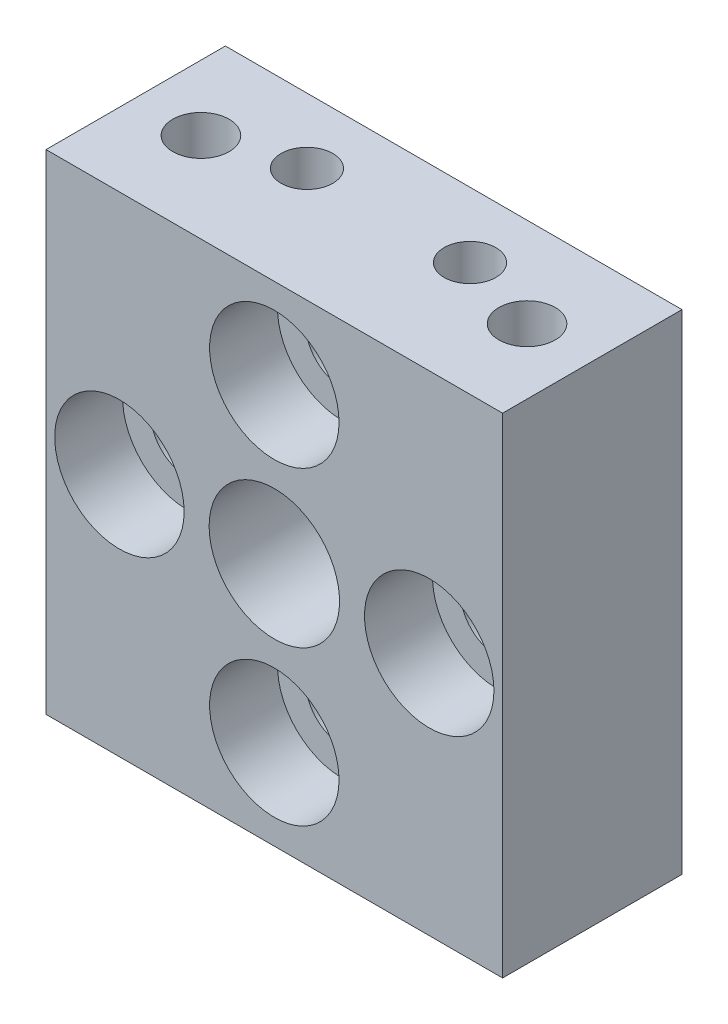
from build123d import *

# Parameters (mm, degrees)
SKETCH1_W                                      = 28
SKETCH1_H                                      = 30
BOSS_EXTRUDE1_DEPTH                            = 11
CBORE_FOR_8_SOCKET_HEAD_CAP_SCREW3_D           = 4.4958
CBORE_FOR_8_SOCKET_HEAD_CAP_SCREW3_CBORE_D     = 7.9375
CBORE_FOR_8_SOCKET_HEAD_CAP_SCREW3_CBORE_DEPTH = 4.1656
F_8_32_TAPPED_HOLE1_AT_2_COUNT                 = 2
F_8_32_TAPPED_HOLE1_AT_2_PITCH                 = 20
F_1_8_0_1250_DOWEL_HOLE1_AT_2_COUNT            = 2
F_1_8_0_1250_DOWEL_HOLE1_AT_2_PITCH            = 10


with BuildPart() as part:
    # Sketch1 → Boss-Extrude1 (new body)
    with BuildSketch(Plane.XY):
        with Locations((14, 0)):
            Rectangle(SKETCH1_W, SKETCH1_H)
    extrude(amount=BOSS_EXTRUDE1_DEPTH)

    # Sketch16 → CBORE for M5 Hex Head Bolt1 (revolve, cut)
    with BuildSketch(Plane.YZ.offset(14)):
        Polygon((0, 0), (0, 11), (4, 11), (4, 3.25), (4.25, 3), (5.5, 3), (5.5, 1), (6.5, 0), align=None)
    revolve(axis=Axis((14, 0, -6.35), (0, 0, 1)), mode=Mode.SUBTRACT)

    # CBORE for #8 Socket Head Cap Screw3 (through all)
    with Locations(Plane.XY.offset(11)):
        with Locations((23.5, 0), (4.5, 0), (14, 9.5), (14, -9.5)):
            CounterBoreHole(CBORE_FOR_8_SOCKET_HEAD_CAP_SCREW3_D / 2, CBORE_FOR_8_SOCKET_HEAD_CAP_SCREW3_CBORE_D / 2, CBORE_FOR_8_SOCKET_HEAD_CAP_SCREW3_CBORE_DEPTH)

    # Sketch13 → #8-32 Tapped Hole1 (revolve, cut)
    with BuildSketch(Plane(origin=(4, 15, 5.5), x_dir=(0, 0, 1), z_dir=(1, 0, 0))):
        Polygon((0, 0), (0, 11.037806461), (1.7272, 10), (1.7272, 0), align=None)
    f_8_32_tapped_hole1 = revolve(axis=Axis((4, 21.35, 5.5), (0, -1, 0)), mode=Mode.SUBTRACT)

    # #8-32 Tapped Hole1 at 2: #8-32 Tapped Hole1 ×2
    with Locations(*[(i * F_8_32_TAPPED_HOLE1_AT_2_PITCH, 0, 0) for i in range(1, F_8_32_TAPPED_HOLE1_AT_2_COUNT)]):
        add(f_8_32_tapped_hole1, mode=Mode.SUBTRACT)

    # Sketch20 → 1/8 (0.1250) Dowel Hole1 (revolve, cut)
    with BuildSketch(Plane(origin=(9, 15, 4), x_dir=(0, 0, 1), z_dir=(1, 0, 0))):
        Polygon((0, 0), (0, 5.953866233), (1.5875, 5), (1.5875, 0), align=None)
    f_1_8_0_1250_dowel_hole1 = revolve(axis=Axis((9, 21.35, 4), (0, -1, 0)), mode=Mode.SUBTRACT)

    # 1/8 (0.1250) Dowel Hole1 at 2: 1/8 (0.1250) Dowel Hole1 ×2
    with Locations(*[(i * F_1_8_0_1250_DOWEL_HOLE1_AT_2_PITCH, 0, 0) for i in range(1, F_1_8_0_1250_DOWEL_HOLE1_AT_2_COUNT)]):
        add(f_1_8_0_1250_dowel_hole1, mode=Mode.SUBTRACT)

    # Mirror1: #8-32 Tapped Hole1, 1/8 (0.1250) Dowel Hole1 across plane
    add(f_8_32_tapped_hole1.mirror(Plane.ZX), mode=Mode.SUBTRACT)
    add(f_1_8_0_1250_dowel_hole1.mirror(Plane.ZX), mode=Mode.SUBTRACT)

    # Mirror1 copy 1 sketch → Mirror1 copy 1 (revolve, cut)
    with BuildSketch(Plane(origin=(24, -15, 5.5), x_dir=(0, 0, 1), z_dir=(1, 0, 0))):
        Polygon((0, 0), (0, -11.037806461), (1.7272, -10), (1.7272, 0), align=None)
    revolve(axis=Axis((24, -21.35, 5.5), (0, -1, 0)), mode=Mode.SUBTRACT)

    # Mirror1 copy 2 sketch → Mirror1 copy 2 (revolve, cut)
    with BuildSketch(Plane(origin=(19, -15, 4), x_dir=(0, 0, 1), z_dir=(1, 0, 0))):
        Polygon((0, 0), (0, -5.953866233), (1.5875, -5), (1.5875, 0), align=None)
    revolve(axis=Axis((19, -21.35, 4), (0, -1, 0)), mode=Mode.SUBTRACT)


solid = part.part
